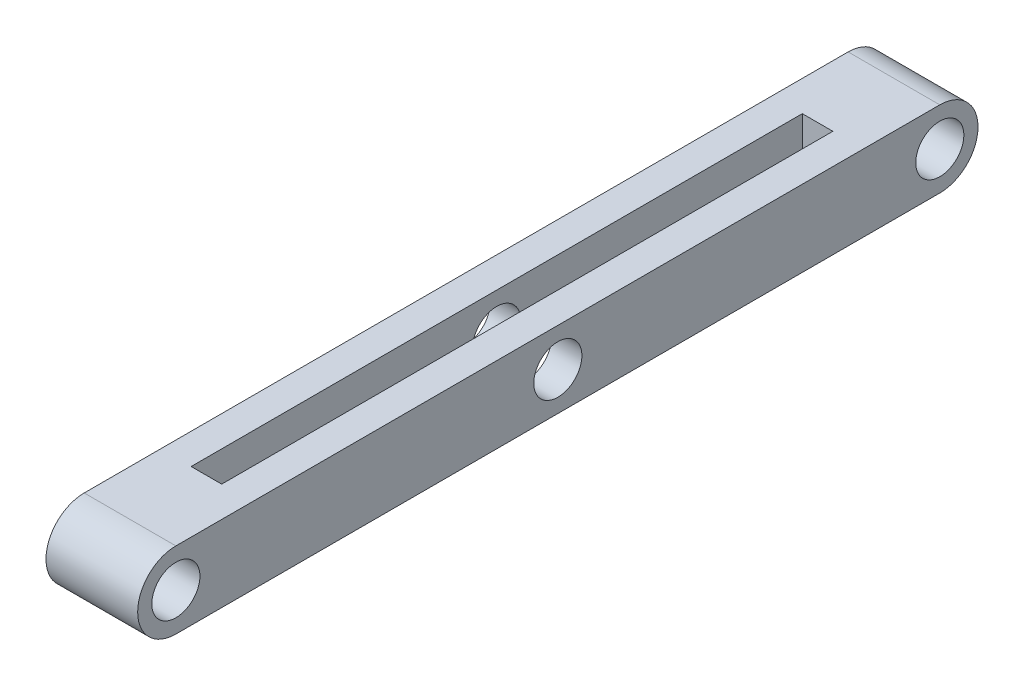
from build123d import *

# Parameters (mm, degrees)
BOSS_EXTRUDE1_DEPTH   = 15.24
F_8_0MM_DOWEL_HOLE1_D = 8
SKETCH5_W             = 5.08
SKETCH5_H             = 101.6
CUT_EXTRUDE1_DEPTH    = 87.135590786


with BuildPart() as part:
    # Sketch1 → Boss-Extrude1 (new body)
    with BuildSketch(Plane(origin=(0, 0, 0), x_dir=(0, 0, -1), z_dir=(1, 0, 0))):
        with BuildLine():
            Line((-77.47, 8.41375), (49.53, 8.41375))
            ThreePointArc((49.53, 8.41375), (55.88, 2.06375), (49.53, -4.28625))
            Line((49.53, -4.28625), (-77.47, -4.28625))
            ThreePointArc((-77.47, -4.28625), (-83.82, 2.06375), (-77.47, 8.41375))
        make_face()
    extrude(amount=BOSS_EXTRUDE1_DEPTH)

    # Ø8.0mm Dowel Hole1 (through all)
    with Locations(Plane(origin=(15.24, 0, 0), x_dir=(0, 0, -1), z_dir=(1, 0, 0))):
        with Locations((-77.47, 2.06375), (49.53, 2.06375), (-13.97, 2.06375)):
            Hole(F_8_0MM_DOWEL_HOLE1_D / 2)

    # Sketch5 → Cut-Extrude1 (cut, through all)
    with BuildSketch(Plane(origin=(0, 8.41375, 0), x_dir=(1, 0, 0), z_dir=(0, 1, 0))):
        with Locations((7.62, -13.97)):
            Rectangle(SKETCH5_W, SKETCH5_H)
    extrude(amount=-CUT_EXTRUDE1_DEPTH, mode=Mode.SUBTRACT)


solid = part.part
